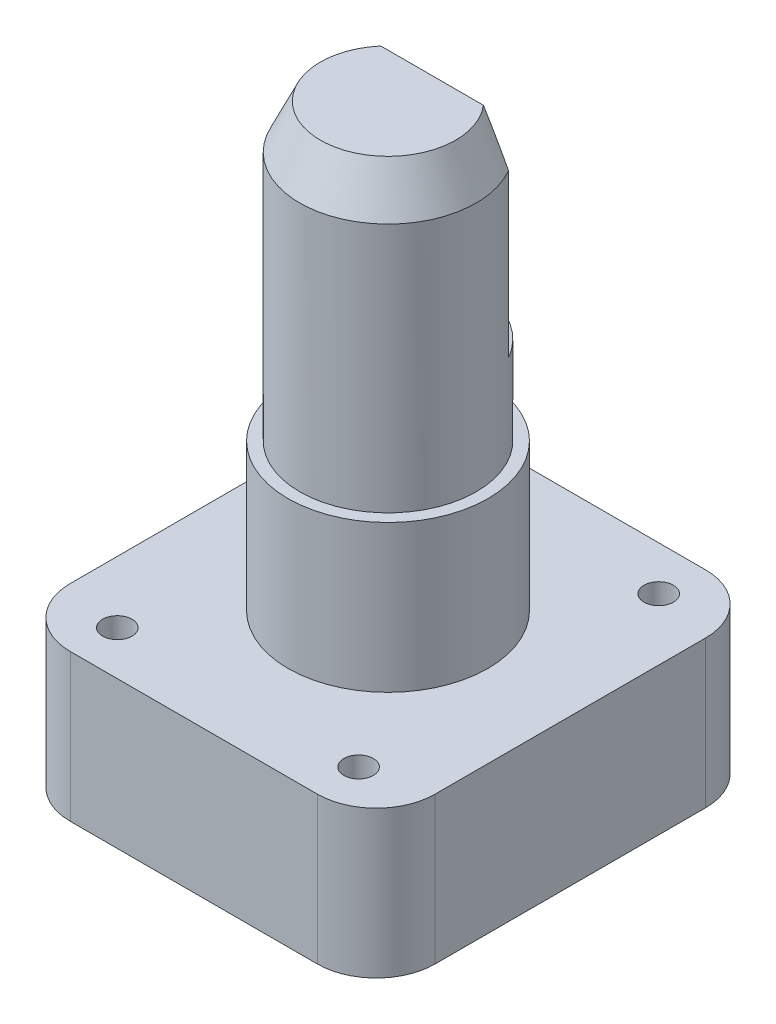
from build123d import *

# Parameters (mm, degrees)
SKETCH1_W           = 12.4
SKETCH1_H           = 13.2
BOSS_EXTRUDE1_DEPTH = 5
FILLET1_R           = 2
SKETCH2_R           = 3.4
BOSS_EXTRUDE2_DEPTH = 5
SKETCH3_R           = 3
BOSS_EXTRUDE3_DEPTH = 10
CHAMFER1_SIZE       = 1.5
CHAMFER1_SIZE2      = 0.699461487
SKETCH4_R           = 0.5
CUT_EXTRUDE1_DEPTH  = 18.521415468
SKETCH5_W           = 6.05122926
SKETCH5_H           = 1.5
CUT_EXTRUDE2_DEPTH  = 7


with BuildPart() as part:
    # Sketch1 → Boss-Extrude1 (new body)
    with BuildSketch(Plane(origin=(0, 0, 0), x_dir=(1, 0, 0), z_dir=(0, 1, 0))):
        Rectangle(SKETCH1_W, SKETCH1_H)
    extrude(amount=BOSS_EXTRUDE1_DEPTH)

    # Fillet1
    fillet1_edges = [part.edges().sort_by_distance(p)[0] for p in [
        (-6.2, 2.5, -6.6),
        (6.2, 2.5, -6.6),
        (6.2, 2.5, 6.6),
        (-6.2, 2.5, 6.6),
    ]]
    fillet(fillet1_edges, radius=FILLET1_R)

    # Sketch2 → Boss-Extrude2 (add)
    with BuildSketch(Plane(origin=(0, 5, 0), x_dir=(1, 0, 0), z_dir=(0, 1, 0))):
        with Locations(Location((0, 0, 0), (0, 0, 270))):
            Circle(SKETCH2_R)
    extrude(amount=BOSS_EXTRUDE2_DEPTH)

    # Sketch3 → Boss-Extrude3 (add)
    with BuildSketch(Plane(origin=(0, 10, 0), x_dir=(1, 0, 0), z_dir=(0, 1, 0))):
        with Locations(Location((0, 0, 0), (0, 0, 270))):
            Circle(SKETCH3_R)
    extrude(amount=BOSS_EXTRUDE3_DEPTH)

    # Chamfer1
    chamfer1_edges = [part.edges().sort_by_distance(p)[0] for p in [
        (0, 20, -3),
    ]]
    chamfer1_side = [part.faces().sort_by_distance(p)[0] for p in [
        (0, 15, -3),
    ]]
    chamfer(chamfer1_edges, length=CHAMFER1_SIZE, length2=CHAMFER1_SIZE2, reference=chamfer1_side[0])

    # Sketch4 → Cut-Extrude1 (cut, through all)
    with BuildSketch(Plane(origin=(0, 5, 0), x_dir=(1, 0, 0), z_dir=(0, 1, 0))):
        with Locations(Location((4.1, -5.1, 0), (0, 0, 270))):
            Circle(SKETCH4_R)
        with Locations(Location((-4.1, -5.1, 0), (0, 0, 270))):
            Circle(SKETCH4_R)
        with Locations(Location((-4.1, 5.1, 0), (0, 0, 270))):
            Circle(SKETCH4_R)
        with Locations(Location((4.1, 5.1, 0), (0, 0, 270))):
            Circle(SKETCH4_R)
    extrude(amount=-CUT_EXTRUDE1_DEPTH, mode=Mode.SUBTRACT)

    # Sketch5 → Cut-Extrude2 (cut)
    with BuildSketch(Plane(origin=(0, 20, 0), x_dir=(1, 0, 0), z_dir=(0, 1, 0))):
        with Locations((0.02561463, 2.25)):
            Rectangle(SKETCH5_W, SKETCH5_H)
    extrude(amount=-CUT_EXTRUDE2_DEPTH, mode=Mode.SUBTRACT)


solid = part.part
